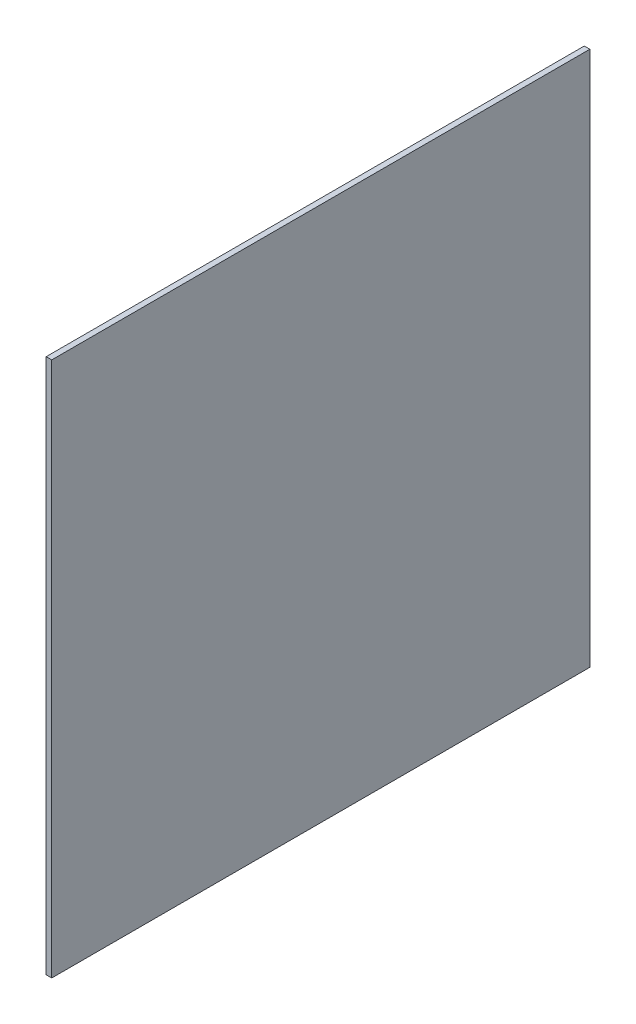
from build123d import *

# Parameters (mm, degrees)
SKETCH2_W           = 193
SKETCH2_H           = 192
BOSS_EXTRUDE2_DEPTH = 2


with BuildPart() as part:
    # Sketch2 → Boss-Extrude2 (new body)
    with BuildSketch(Plane(origin=(0, 0, 0), x_dir=(0, 0, -1), z_dir=(1, 0, 0))):
        with Locations((134.758549932, -216.529885945)):
            Rectangle(SKETCH2_W, SKETCH2_H)
    extrude(amount=BOSS_EXTRUDE2_DEPTH)


solid = part.part
